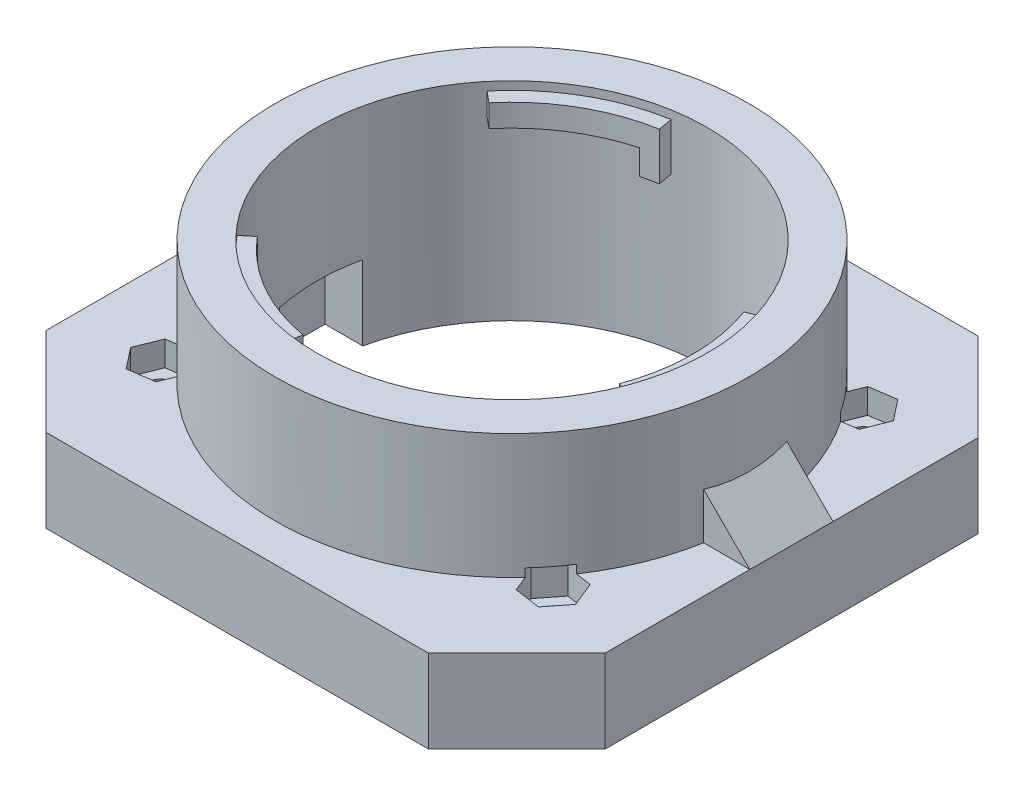
from build123d import *

# Parameters (mm, degrees)
SKETCH_1_R               = 23.5
SKETCH_1_R_2             = 1.5
EXTRUDE_1_DEPTH          = 10
SKETCH_2_R               = 28.5
SKETCH_2_R_2             = 23.5
EXTRUDE_2_DEPTH          = 25
SKETCH_5_W               = 55
SKETCH_5_H               = 10
CUT_EXTRUDE_1_DEPTH      = 9
RIB_6_REACH              = 55.364
SKETCH_7_WALL_W          = 123.679532162
SKETCH_7_WALL_H          = 10
CUT_EXTRUDE_2_DEPTH      = 1
CUT_EXTRUDE_2_DEPTH_BACK = 3
CUT_EXTRUDE_2_START      = 10
EXTRUDE_START            = -3.7
EXTRUDE_3_DEPTH          = 2.7
EXTRUDE_START_2          = -6.7
EXTRUDE_5_DEPTH          = 3


with BuildPart() as part:
    # 草图1 → 凸台-拉伸1 (new body)
    with BuildSketch(Plane(origin=(0, 0, 0), x_dir=(1, 0, 0), z_dir=(0, 1, 0))):
        Polygon((-23.015398282, 33.05), (23.015398282, 33.05), (33.622, 22.443398282), (33.622, -22.443398282), (23.015398282, -33.05), (-23.015398282, -33.05), (-33.622, -22.443398282), (-33.622, 22.443398282), align=None)
        with Locations(Location((0, 0, 0), (0, 0, 270))):
            Circle(SKETCH_1_R, mode=Mode.SUBTRACT)
        with Locations(Location((-23.622, 18.669, 0), (0, 0, 270))):
            Circle(SKETCH_1_R_2, mode=Mode.SUBTRACT)
        with Locations(Location((23.622, 18.669, 0), (0, 0, 270))):
            Circle(SKETCH_1_R_2, mode=Mode.SUBTRACT)
        with Locations(Location((23.622, -18.669, 0), (0, 0, 270))):
            Circle(SKETCH_1_R_2, mode=Mode.SUBTRACT)
        with Locations(Location((-23.622, -18.669, 0), (0, 0, 270))):
            Circle(SKETCH_1_R_2, mode=Mode.SUBTRACT)
    extrude(amount=EXTRUDE_1_DEPTH)

    # 草图2 → 凸台-拉伸2 (add)
    with BuildSketch(Plane(origin=(0, 0, 0), x_dir=(1, 0, 0), z_dir=(0, 1, 0))):
        with Locations(Location((0, 0, 0), (0, 0, 90))):
            Circle(SKETCH_2_R)
        with Locations(Location((0, 0, 0), (0, 0, 270))):
            Circle(SKETCH_2_R_2, mode=Mode.SUBTRACT)
    extrude(amount=EXTRUDE_2_DEPTH)

    # 草图5 → 切除-拉伸1 (cut)
    with BuildSketch(Plane(origin=(0, 0, 0), x_dir=(1, 0, 0), z_dir=(0, 1, 0))):
        Rectangle(SKETCH_5_W, SKETCH_5_H)
    extrude(amount=CUT_EXTRUDE_1_DEPTH, mode=Mode.SUBTRACT)

    # 草图7 wall → 筋6 (add, up to next)
    with BuildSketch(Plane(origin=(-28.336, 15.286, 0), x_dir=(0.707106781187, 0.707106781187, 0), z_dir=(-0.707106781187, 0.707106781187, 0)), mode=Mode.PRIVATE) as rib_6_sk1:
        Rectangle(SKETCH_7_WALL_W, SKETCH_7_WALL_H)
    rib_6_tool1 = extrude(rib_6_sk1.sketch, amount=-RIB_6_REACH, mode=Mode.PRIVATE) - part.part
    rib_6 = rib_6_tool1.solids().sort_by_distance((-28.336, 15.286, 0))[0]
    add(rib_6)

    # 镜向1: 筋6 across plane
    add(rib_6.mirror(Plane(origin=(0, 0, 0), x_dir=(0, 0, 1), z_dir=(1, 0, 0))))

    # 草图9 → 切除-拉伸2 (cut, two sides: drawn at the far end of the back side and taken through both)
    with BuildSketch(Plane(origin=(0, 0, 0), x_dir=(1, 0, 0), z_dir=(0, 1, 0)).offset(CUT_EXTRUDE_2_START - CUT_EXTRUDE_2_DEPTH_BACK)):
        Polygon((-24.807031722, -21.615019883), (-21.663187802, -21.168277517), (-20.47815608, -18.222257634), (-22.436968278, -15.722980117), (-25.580812198, -16.169722483), (-26.76584392, -19.115742366), align=None)
        Polygon((26.76584392, -19.115742366), (25.580812198, -16.169722483), (22.436968278, -15.722980117), (20.47815608, -18.222257634), (21.663187802, -21.168277517), (24.807031722, -21.615019883), align=None)
        Polygon((25.601030295, 16.185701302), (26.762114905, 19.141241161), (24.783084611, 21.624539859), (21.642969705, 21.152298698), (20.481885095, 18.196758839), (22.460915389, 15.713460141), align=None)
        Polygon((-25.601030295, 16.185701302), (-22.460915389, 15.713460141), (-20.481885095, 18.196758839), (-21.642969705, 21.152298698), (-24.783084611, 21.624539859), (-26.762114905, 19.141241161), align=None)
    extrude(amount=CUT_EXTRUDE_2_DEPTH + CUT_EXTRUDE_2_DEPTH_BACK, mode=Mode.SUBTRACT)

    # 草图10 → 凸台-拉伸3 (add)
    with BuildSketch(Plane(origin=(0, 25, 0), x_dir=(1, 0, 0), z_dir=(0, 1, 0)).offset(EXTRUDE_START)):
        with BuildLine():
            ThreePointArc((-6.121524921, 22.688696142), (-12.673279961, 19.78984525), (-18.047118042, 15.051628828))
            Line((-18.047118042, 15.051628828), (-16.70318372, 13.930762851))
            ThreePointArc((-16.70318372, 13.930762851), (-11.72952507, 18.31613337), (-5.665666682, 20.999112387))
            Line((-5.665666682, 20.999112387), (-6.121524921, 22.688696142))
        make_face()
        with BuildLine():
            Line((-3.712802663, 21.430762851), (-4.011533912, 23.155077104))
            ThreePointArc((-4.011533912, 23.155077104), (-5.071892953, 22.946152224), (-6.121524921, 22.688696142))
            Line((-6.121524921, 22.688696142), (-5.665666682, 20.999112387))
            ThreePointArc((-5.665666682, 20.999112387), (-4.694198797, 21.237396207), (-3.712802663, 21.430762851))
        make_face()
        with BuildLine():
            Line((21.018598125, -5.592944917), (22.709749699, -6.04295198))
            ThreePointArc((22.709749699, -6.04295198), (23.301599923, -3.047202166), (23.5, 0))
            ThreePointArc((23.5, 0), (23.136857186, 4.115317671), (22.058651954, 8.103448276))
            Line((22.058651954, 8.103448276), (20.415986383, 7.5))
            ThreePointArc((20.415986383, 7.5), (21.413899736, 3.808857845), (21.75, 0))
            ThreePointArc((21.75, 0), (21.566374397, -2.820282856), (21.018598125, -5.592944917))
        make_face()
        with BuildLine():
            Line((20.415986383, -7.5), (22.058651954, -8.103448276))
            ThreePointArc((22.058651954, -8.103448276), (22.407897221, -7.080687969), (22.709749699, -6.04295198))
            Line((22.709749699, -6.04295198), (21.018598125, -5.592944917))
            ThreePointArc((21.018598125, -5.592944917), (20.739224024, -6.553402695), (20.415986383, -7.5))
        make_face()
        with BuildLine():
            ThreePointArc((-16.588224778, -16.645744163), (-10.801868743, -20.870305021), (-4.011533912, -23.155077104))
            Line((-4.011533912, -23.155077104), (-3.712802663, -21.430762851))
            ThreePointArc((-3.712802663, -21.430762851), (-9.997474263, -19.31613337), (-15.352931443, -15.40616747))
            Line((-15.352931443, -15.40616747), (-16.588224778, -16.645744163))
        make_face()
        with BuildLine():
            ThreePointArc((-18.047118042, -15.051628828), (-17.336004268, -15.865464255), (-16.588224778, -16.645744163))
            Line((-16.588224778, -16.645744163), (-15.352931443, -15.40616747))
            ThreePointArc((-15.352931443, -15.40616747), (-16.045025227, -14.683993512), (-16.70318372, -13.930762851))
            Line((-16.70318372, -13.930762851), (-18.047118042, -15.051628828))
        make_face()
    extrude(amount=EXTRUDE_3_DEPTH)

    # 草图10<3> → 凸台-拉伸5 (add)
    with BuildSketch(Plane(origin=(0, 25, 0), x_dir=(1, 0, 0), z_dir=(0, 1, 0)).offset(EXTRUDE_START_2)):
        with BuildLine():
            Line((-3.712802663, 21.430762851), (-4.011533912, 23.155077104))
            ThreePointArc((-4.011533912, 23.155077104), (-5.071892953, 22.946152224), (-6.121524921, 22.688696142))
            Line((-6.121524921, 22.688696142), (-5.665666682, 20.999112387))
            ThreePointArc((-5.665666682, 20.999112387), (-4.694198797, 21.237396207), (-3.712802663, 21.430762851))
        make_face()
        with BuildLine():
            ThreePointArc((-18.047118042, -15.051628828), (-17.336004268, -15.865464255), (-16.588224778, -16.645744163))
            Line((-16.588224778, -16.645744163), (-15.352931443, -15.40616747))
            ThreePointArc((-15.352931443, -15.40616747), (-16.045025227, -14.683993512), (-16.70318372, -13.930762851))
            Line((-16.70318372, -13.930762851), (-18.047118042, -15.051628828))
        make_face()
        with BuildLine():
            Line((20.415986383, -7.5), (22.058651954, -8.103448276))
            ThreePointArc((22.058651954, -8.103448276), (22.407897221, -7.080687969), (22.709749699, -6.04295198))
            Line((22.709749699, -6.04295198), (21.018598125, -5.592944917))
            ThreePointArc((21.018598125, -5.592944917), (20.739224024, -6.553402695), (20.415986383, -7.5))
        make_face()
    extrude(amount=EXTRUDE_5_DEPTH)


solid = part.part
